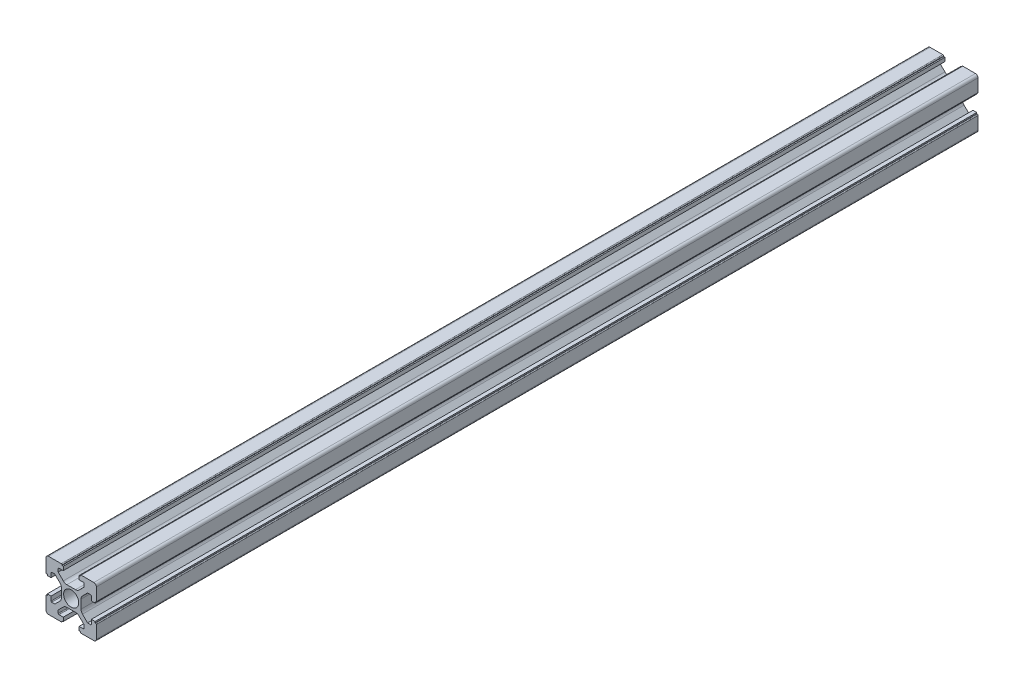
from build123d import *

# Parameters (mm, degrees)
SKETCH_1_R      = 3
EXTRUDE_1_DEPTH = 350


with BuildPart() as part:
    # 草图1 → 凸台-拉伸1 (new body)
    with BuildSketch(Plane.XY):
        with BuildLine():
            Line((-10, -9), (-10, -3.95))
            add(Edge.make_bspline(
                [(-9.7, -3.65), (-10, -3.65), (-10, -3.95)],
                knots=[4.71238898, 4.71238898, 4.71238898, 6.283185307, 6.283185307, 6.283185307], degree=2, weights=[1, 0.707106781, 1]))
            Line((-9.7, -3.65), (-9.5, -3.65))
            Line((-9.5, -3.65), (-9.5, -3.15))
            Line((-9.5, -3.15), (-8, -3.15))
            Line((-8, -3.15), (-8, -4.85))
            add(Edge.make_bspline(
                [(-8, -4.85), (-8, -5.15), (-7.7, -5.15)],
                knots=[3.141592654, 3.141592654, 3.141592654, 4.71238898, 4.71238898, 4.71238898], degree=2, weights=[1, 0.707106781, 1]))
            Line((-7.7, -5.15), (-6.5, -5.15))
            Line((-6.5, -5.15), (-4.485786438, -3.135786438))
            add(Edge.make_bspline(
                [(-4.485786438, -3.135786438), (-3.9, -2.55), (-3.9, -1.721572875)],
                knots=[0.785398163, 0.785398163, 0.785398163, 1.570796327, 1.570796327, 1.570796327], degree=2, weights=[1, 0.923879533, 1]))
            Line((-3.9, -1.721572875), (-3.9, 1.721572875))
            add(Edge.make_bspline(
                [(-3.9, 1.721572875), (-3.9, 2.55), (-4.485786438, 3.135786438)],
                knots=[0, 0, 0, 0.785398163, 0.785398163, 0.785398163], degree=2, weights=[1, 0.923879533, 1]))
            Line((-4.485786438, 3.135786438), (-6.5, 5.15))
            Line((-6.5, 5.15), (-7.7, 5.15))
            add(Edge.make_bspline(
                [(-7.7, 5.15), (-8, 5.15), (-8, 4.85)],
                knots=[1.570796327, 1.570796327, 1.570796327, 3.141592654, 3.141592654, 3.141592654], degree=2, weights=[1, 0.707106781, 1]))
            Line((-8, 4.85), (-8, 3.15))
            Line((-8, 3.15), (-9.5, 3.15))
            Line((-9.5, 3.15), (-9.5, 3.65))
            Line((-9.5, 3.65), (-9.7, 3.65))
            add(Edge.make_bspline(
                [(-10, 3.95), (-10, 3.65), (-9.7, 3.65)],
                knots=[3.141592654, 3.141592654, 3.141592654, 4.71238898, 4.71238898, 4.71238898], degree=2, weights=[1, 0.707106781, 1]))
            Line((-10, 3.95), (-10, 9))
            add(Edge.make_bspline(
                [(-9, 10), (-10, 10), (-10, 9)],
                knots=[4.71238898, 4.71238898, 4.71238898, 6.283185307, 6.283185307, 6.283185307], degree=2, weights=[1, 0.707106781, 1]))
            Line((-9, 10), (-3.95, 10))
            add(Edge.make_bspline(
                [(-3.65, 9.7), (-3.65, 10), (-3.95, 10)],
                knots=[0, 0, 0, 1.570796327, 1.570796327, 1.570796327], degree=2, weights=[1, 0.707106781, 1]))
            Line((-3.65, 9.7), (-3.65, 9.5))
            Line((-3.65, 9.5), (-3.15, 9.5))
            Line((-3.15, 9.5), (-3.15, 8))
            Line((-3.15, 8), (-4.85, 8))
            add(Edge.make_bspline(
                [(-4.85, 8), (-5.15, 8), (-5.15, 7.7)],
                knots=[1.570796327, 1.570796327, 1.570796327, 3.141592654, 3.141592654, 3.141592654], degree=2, weights=[1, 0.707106781, 1]))
            Line((-5.15, 7.7), (-5.15, 6.5))
            Line((-5.15, 6.5), (-3.135786438, 4.485786438))
            add(Edge.make_bspline(
                [(-3.135786438, 4.485786438), (-2.55, 3.9), (-1.721572875, 3.9)],
                knots=[3.926990817, 3.926990817, 3.926990817, 4.71238898, 4.71238898, 4.71238898], degree=2, weights=[1, 0.923879533, 1]))
            Line((-1.721572875, 3.9), (1.721572875, 3.9))
            add(Edge.make_bspline(
                [(1.721572875, 3.9), (2.55, 3.9), (3.135786438, 4.485786438)],
                knots=[4.71238898, 4.71238898, 4.71238898, 5.497787144, 5.497787144, 5.497787144], degree=2, weights=[1, 0.923879533, 1]))
            Line((3.135786438, 4.485786438), (5.15, 6.5))
            Line((5.15, 6.5), (5.15, 7.7))
            add(Edge.make_bspline(
                [(5.15, 7.7), (5.15, 8), (4.85, 8)],
                knots=[4.71238898, 4.71238898, 4.71238898, 6.283185307, 6.283185307, 6.283185307], degree=2, weights=[1, 0.707106781, 1]))
            Line((4.85, 8), (3.15, 8))
            Line((3.15, 8), (3.15, 9.5))
            Line((3.15, 9.5), (3.65, 9.5))
            Line((3.65, 9.5), (3.65, 9.7))
            add(Edge.make_bspline(
                [(3.95, 10), (3.65, 10), (3.65, 9.7)],
                knots=[0, 0, 0, 1.570796327, 1.570796327, 1.570796327], degree=2, weights=[1, 0.707106781, 1]))
            Line((3.95, 10), (9, 10))
            add(Edge.make_bspline(
                [(10, 9), (10, 10), (9, 10)],
                knots=[0, 0, 0, 1.570796327, 1.570796327, 1.570796327], degree=2, weights=[1, 0.707106781, 1]))
            Line((10, 9), (10, 3.95))
            add(Edge.make_bspline(
                [(9.7, 3.65), (10, 3.65), (10, 3.95)],
                knots=[4.71238898, 4.71238898, 4.71238898, 6.283185307, 6.283185307, 6.283185307], degree=2, weights=[1, 0.707106781, 1]))
            Line((9.7, 3.65), (9.5, 3.65))
            Line((9.5, 3.65), (9.5, 3.15))
            Line((9.5, 3.15), (8, 3.15))
            Line((8, 3.15), (8, 4.85))
            add(Edge.make_bspline(
                [(8, 4.85), (8, 5.15), (7.7, 5.15)],
                knots=[0, 0, 0, 1.570796327, 1.570796327, 1.570796327], degree=2, weights=[1, 0.707106781, 1]))
            Line((7.7, 5.15), (6.5, 5.15))
            Line((6.5, 5.15), (4.485786438, 3.135786438))
            add(Edge.make_bspline(
                [(4.485786438, 3.135786438), (3.9, 2.55), (3.9, 1.721572875)],
                knots=[2.35619449, 2.35619449, 2.35619449, 3.141592654, 3.141592654, 3.141592654], degree=2, weights=[1, 0.923879533, 1]))
            Line((3.9, 1.721572875), (3.9, -1.721572875))
            add(Edge.make_bspline(
                [(3.9, -1.721572875), (3.9, -2.55), (4.485786438, -3.135786438)],
                knots=[3.141592654, 3.141592654, 3.141592654, 3.926990817, 3.926990817, 3.926990817], degree=2, weights=[1, 0.923879533, 1]))
            Line((4.485786438, -3.135786438), (6.5, -5.15))
            Line((6.5, -5.15), (7.7, -5.15))
            add(Edge.make_bspline(
                [(7.7, -5.15), (8, -5.15), (8, -4.85)],
                knots=[4.71238898, 4.71238898, 4.71238898, 6.283185307, 6.283185307, 6.283185307], degree=2, weights=[1, 0.707106781, 1]))
            Line((8, -4.85), (8, -3.15))
            Line((8, -3.15), (9.5, -3.15))
            Line((9.5, -3.15), (9.5, -3.65))
            Line((9.5, -3.65), (9.7, -3.65))
            add(Edge.make_bspline(
                [(10, -3.95), (10, -3.65), (9.7, -3.65)],
                knots=[0, 0, 0, 1.570796327, 1.570796327, 1.570796327], degree=2, weights=[1, 0.707106781, 1]))
            Line((10, -3.95), (10, -9))
            add(Edge.make_bspline(
                [(9, -10), (10, -10), (10, -9)],
                knots=[4.71238898, 4.71238898, 4.71238898, 6.283185307, 6.283185307, 6.283185307], degree=2, weights=[1, 0.707106781, 1]))
            Line((9, -10), (3.95, -10))
            add(Edge.make_bspline(
                [(3.65, -9.7), (3.65, -10), (3.95, -10)],
                knots=[1.570796327, 1.570796327, 1.570796327, 3.141592654, 3.141592654, 3.141592654], degree=2, weights=[1, 0.707106781, 1]))
            Line((3.65, -9.7), (3.65, -9.5))
            Line((3.65, -9.5), (3.15, -9.5))
            Line((3.15, -9.5), (3.15, -8))
            Line((3.15, -8), (4.85, -8))
            add(Edge.make_bspline(
                [(4.85, -8), (5.15, -8), (5.15, -7.7)],
                knots=[3.141592654, 3.141592654, 3.141592654, 4.71238898, 4.71238898, 4.71238898], degree=2, weights=[1, 0.707106781, 1]))
            Line((5.15, -7.7), (5.15, -6.5))
            Line((5.15, -6.5), (3.135786438, -4.485786438))
            add(Edge.make_bspline(
                [(3.135786438, -4.485786438), (2.55, -3.9), (1.721572875, -3.9)],
                knots=[2.35619449, 2.35619449, 2.35619449, 3.141592654, 3.141592654, 3.141592654], degree=2, weights=[1, 0.923879533, 1]))
            Line((1.721572875, -3.9), (-1.721572875, -3.9))
            add(Edge.make_bspline(
                [(-1.721572875, -3.9), (-2.55, -3.9), (-3.135786438, -4.485786438)],
                knots=[0, 0, 0, 0.785398163, 0.785398163, 0.785398163], degree=2, weights=[1, 0.923879533, 1]))
            Line((-3.135786438, -4.485786438), (-5.15, -6.5))
            Line((-5.15, -6.5), (-5.15, -7.7))
            add(Edge.make_bspline(
                [(-5.15, -7.7), (-5.15, -8), (-4.85, -8)],
                knots=[3.141592654, 3.141592654, 3.141592654, 4.71238898, 4.71238898, 4.71238898], degree=2, weights=[1, 0.707106781, 1]))
            Line((-4.85, -8), (-3.15, -8))
            Line((-3.15, -8), (-3.15, -9.5))
            Line((-3.15, -9.5), (-3.65, -9.5))
            Line((-3.65, -9.5), (-3.65, -9.7))
            add(Edge.make_bspline(
                [(-3.95, -10), (-3.65, -10), (-3.65, -9.7)],
                knots=[4.71238898, 4.71238898, 4.71238898, 6.283185307, 6.283185307, 6.283185307], degree=2, weights=[1, 0.707106781, 1]))
            Line((-3.95, -10), (-9, -10))
            add(Edge.make_bspline(
                [(-10, -9), (-10, -10), (-9, -10)],
                knots=[0, 0, 0, 1.570796327, 1.570796327, 1.570796327], degree=2, weights=[1, 0.707106781, 1]))
        make_face()
        Circle(SKETCH_1_R, mode=Mode.SUBTRACT)
    extrude(amount=EXTRUDE_1_DEPTH)


solid = part.part
